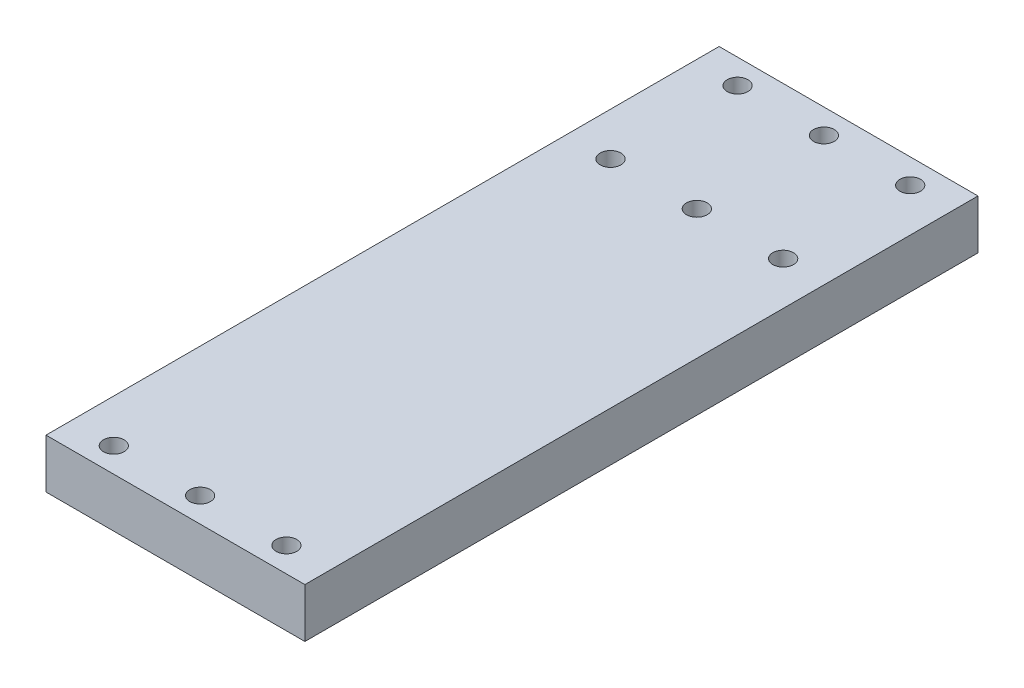
from build123d import *

# Parameters (mm, degrees)
SKETCH2_W             = 50
SKETCH2_H             = 130
BOSS_EXTRUDE1_DEPTH   = 9.525
F_4_0MM_DOWEL_HOLE1_D = 4


with BuildPart() as part:
    # Sketch2 → Boss-Extrude1 (new body)
    with BuildSketch(Plane(origin=(0, 0, 0), x_dir=(1, 0, 0), z_dir=(0, 1, 0))):
        Rectangle(SKETCH2_W, SKETCH2_H)
    extrude(amount=BOSS_EXTRUDE1_DEPTH)

    # Ø4.0mm Dowel Hole1 (through all)
    with Locations(Plane(origin=(0, 9.525, 0), x_dir=(1, 0, 0), z_dir=(0, 1, 0))):
        with Locations((16.67, 60.2375), (-16.67, -60.2375), (0, -60.2375), (16.67, -60.2375), (-16.67, 35.7), (0, 35.7), (16.67, 35.7), (-16.67, 60.2375), (0, 60.2375)):
            Hole(F_4_0MM_DOWEL_HOLE1_D / 2)


solid = part.part
